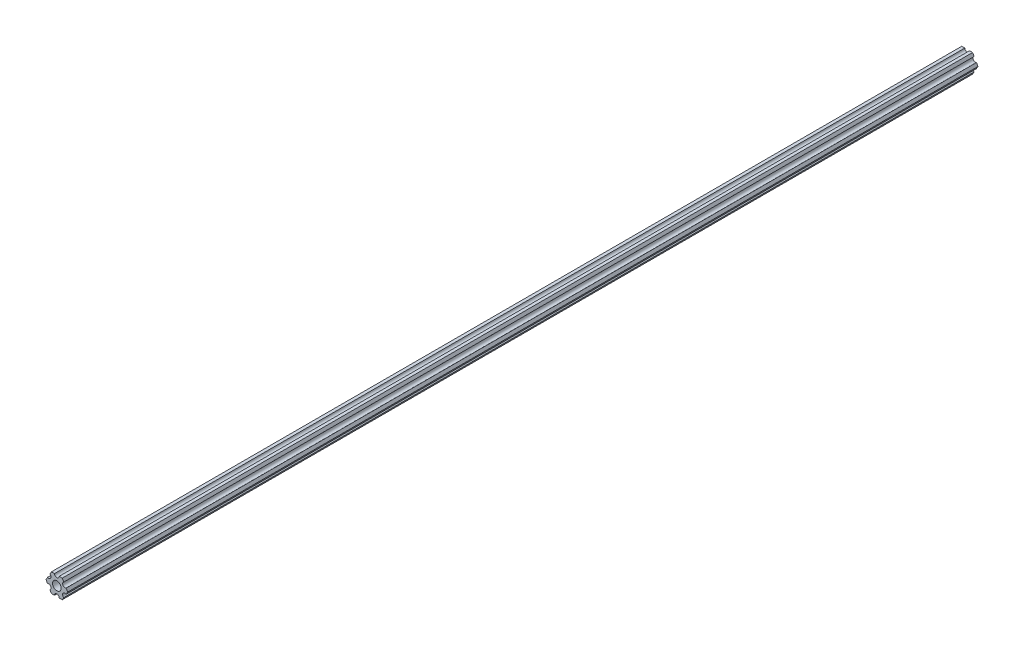
from build123d import *

# Parameters (mm, degrees)
SKETCH1_R           = 2.9337
BOSS_EXTRUDE1_DEPTH = 615.95


with BuildPart() as part:
    # Sketch1 → Boss-Extrude1 (new body)
    with BuildSketch(Plane.XY):
        with BuildLine():
            Line((3.666174176, -6.349999977), (4.705511247, -4.549815325))
            ThreePointArc((4.705511247, -4.549815325), (4.124445898, -2.381250002), (6.293011221, -1.800184653))
            Line((6.293011221, -1.800184653), (7.332348293, 0))
            Line((7.332348293, 0), (6.293011221, 1.800184653))
            ThreePointArc((6.293011221, 1.800184653), (4.124445898, 2.381250002), (4.705511247, 4.549815325))
            Line((4.705511247, 4.549815325), (3.666174176, 6.349999977))
            Line((3.666174176, 6.349999977), (1.5875, 6.349999977))
            ThreePointArc((1.5875, 6.349999977), (0, 4.762499977), (-1.5875, 6.349999977))
            Line((-1.5875, 6.349999977), (-3.666174176, 6.349999977))
            Line((-3.666174176, 6.349999977), (-4.705511247, 4.549815325))
            ThreePointArc((-4.705511247, 4.549815325), (-4.124445898, 2.381250002), (-6.293011221, 1.800184653))
            Line((-6.293011221, 1.800184653), (-7.332348293, 0))
            Line((-7.332348293, 0), (-6.293011221, -1.800184653))
            ThreePointArc((-6.293011221, -1.800184653), (-4.124445898, -2.381250002), (-4.705511247, -4.549815325))
            Line((-4.705511247, -4.549815325), (-3.666174176, -6.349999977))
            Line((-3.666174176, -6.349999977), (-1.5875, -6.349999977))
            ThreePointArc((-1.5875, -6.349999977), (0, -4.762499977), (1.5875, -6.349999977))
            Line((1.5875, -6.349999977), (3.666174176, -6.349999977))
        make_face()
        with Locations(Location((0, 0, 0), (0, 0, 180))):
            Circle(SKETCH1_R, mode=Mode.SUBTRACT)
    extrude(amount=-BOSS_EXTRUDE1_DEPTH)


solid = part.part
